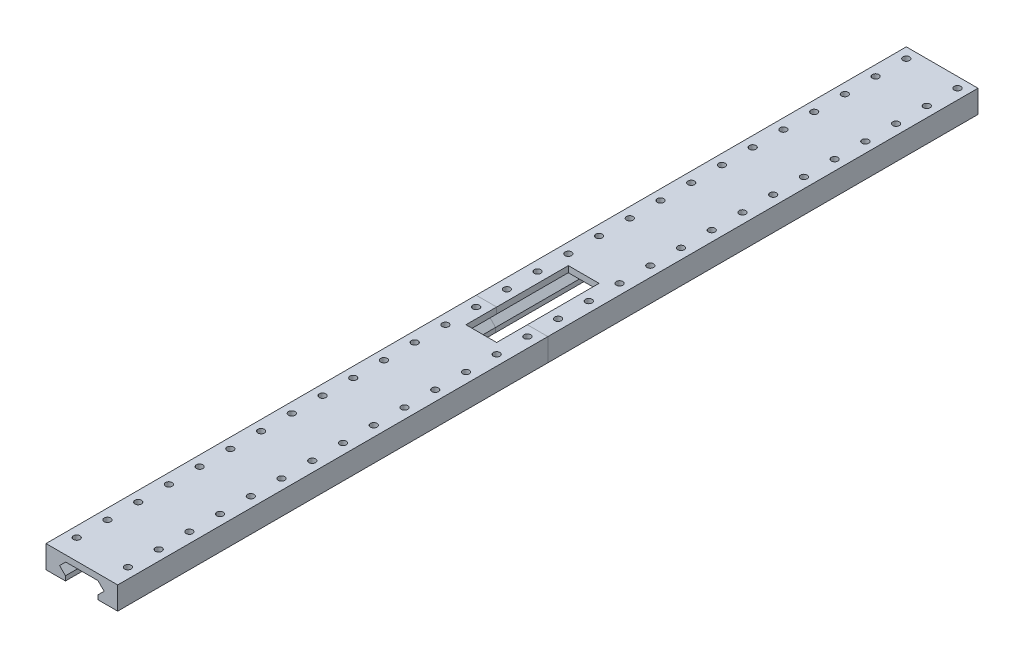
from build123d import *

# Parameters (mm, degrees)
EXTRUDE_2_DEPTH     = 420
SKETCH_3_R          = 1.6
CUT_EXTRUDE_1_DEPTH = 421.510951106
SKETCH_4_W          = 15
SKETCH_4_H          = 50
CUT_EXTRUDE_2_DEPTH = 421.510951106


with BuildPart() as part:
    # 草图1 → 凸台-拉伸2 (new body)
    with BuildSketch(Plane.XY):
        Polygon((8, 3.5), (17.5, 3.5), (17.5, 14.6), (-17.5, 14.6), (-17.5, 3.5), (-8, 3.5), (-8, 5.717157288), (-10.882842712, 8.6), (-7.882842712, 11.6), (7.882842712, 11.6), (10.882842712, 8.6), (8, 5.717157288), align=None)
    extrude(amount=EXTRUDE_2_DEPTH)

    # 草图3 → 切除-拉伸1 (cut, through all)
    with BuildSketch(Plane(origin=(0, 14.6, 0), x_dir=(1, 0, 0), z_dir=(0, 1, 0))):
        with Locations(Location((-12.5, -5, 0), (0, 0, 180))):
            Circle(SKETCH_3_R)
        with Locations(Location((-12.5, -20, 0), (0, 0, 180))):
            Circle(SKETCH_3_R)
        with Locations(Location((-12.5, -35, 0), (0, 0, 180))):
            Circle(SKETCH_3_R)
        with Locations(Location((-12.5, -50, 0), (0, 0, 180))):
            Circle(SKETCH_3_R)
        with Locations(Location((-12.5, -65, 0), (0, 0, 180))):
            Circle(SKETCH_3_R)
        with Locations(Location((-12.5, -80, 0), (0, 0, 180))):
            Circle(SKETCH_3_R)
        with Locations(Location((-12.5, -95, 0), (0, 0, 180))):
            Circle(SKETCH_3_R)
        with Locations(Location((-12.5, -110, 0), (0, 0, 180))):
            Circle(SKETCH_3_R)
        with Locations(Location((-12.5, -125, 0), (0, 0, 180))):
            Circle(SKETCH_3_R)
        with Locations(Location((-12.5, -140, 0), (0, 0, 180))):
            Circle(SKETCH_3_R)
        with Locations(Location((-12.5, -155, 0), (0, 0, 180))):
            Circle(SKETCH_3_R)
        with Locations(Location((-12.5, -170, 0), (0, 0, 180))):
            Circle(SKETCH_3_R)
        with Locations(Location((-12.5, -185, 0), (0, 0, 180))):
            Circle(SKETCH_3_R)
        with Locations(Location((-12.5, -200, 0), (0, 0, 180))):
            Circle(SKETCH_3_R)
        with Locations(Location((-12.5, -215, 0), (0, 0, 180))):
            Circle(SKETCH_3_R)
        with Locations(Location((-12.5, -230, 0), (0, 0, 180))):
            Circle(SKETCH_3_R)
        with Locations(Location((-12.5, -245, 0), (0, 0, 180))):
            Circle(SKETCH_3_R)
        with Locations(Location((-12.5, -260, 0), (0, 0, 180))):
            Circle(SKETCH_3_R)
        with Locations(Location((-12.5, -275, 0), (0, 0, 180))):
            Circle(SKETCH_3_R)
        with Locations(Location((-12.5, -290, 0), (0, 0, 180))):
            Circle(SKETCH_3_R)
        with Locations(Location((-12.5, -305, 0), (0, 0, 180))):
            Circle(SKETCH_3_R)
        with Locations(Location((-12.5, -320, 0), (0, 0, 180))):
            Circle(SKETCH_3_R)
        with Locations(Location((-12.5, -335, 0), (0, 0, 180))):
            Circle(SKETCH_3_R)
        with Locations(Location((-12.5, -350, 0), (0, 0, 180))):
            Circle(SKETCH_3_R)
        with Locations(Location((-12.5, -365, 0), (0, 0, 180))):
            Circle(SKETCH_3_R)
        with Locations(Location((-12.5, -380, 0), (0, 0, 180))):
            Circle(SKETCH_3_R)
        with Locations(Location((-12.5, -395, 0), (0, 0, 180))):
            Circle(SKETCH_3_R)
        with Locations(Location((-12.5, -410, 0), (0, 0, 180))):
            Circle(SKETCH_3_R)
        with Locations((12.5, -410)):
            Circle(SKETCH_3_R)
        with Locations((12.5, -395)):
            Circle(SKETCH_3_R)
        with Locations((12.5, -380)):
            Circle(SKETCH_3_R)
        with Locations((12.5, -365)):
            Circle(SKETCH_3_R)
        with Locations((12.5, -350)):
            Circle(SKETCH_3_R)
        with Locations((12.5, -335)):
            Circle(SKETCH_3_R)
        with Locations((12.5, -320)):
            Circle(SKETCH_3_R)
        with Locations((12.5, -305)):
            Circle(SKETCH_3_R)
        with Locations((12.5, -290)):
            Circle(SKETCH_3_R)
        with Locations((12.5, -275)):
            Circle(SKETCH_3_R)
        with Locations((12.5, -260)):
            Circle(SKETCH_3_R)
        with Locations((12.5, -245)):
            Circle(SKETCH_3_R)
        with Locations((12.5, -230)):
            Circle(SKETCH_3_R)
        with Locations((12.5, -215)):
            Circle(SKETCH_3_R)
        with Locations((12.5, -200)):
            Circle(SKETCH_3_R)
        with Locations((12.5, -185)):
            Circle(SKETCH_3_R)
        with Locations((12.5, -170)):
            Circle(SKETCH_3_R)
        with Locations((12.5, -155)):
            Circle(SKETCH_3_R)
        with Locations((12.5, -140)):
            Circle(SKETCH_3_R)
        with Locations((12.5, -125)):
            Circle(SKETCH_3_R)
        with Locations((12.5, -110)):
            Circle(SKETCH_3_R)
        with Locations((12.5, -95)):
            Circle(SKETCH_3_R)
        with Locations((12.5, -80)):
            Circle(SKETCH_3_R)
        with Locations((12.5, -65)):
            Circle(SKETCH_3_R)
        with Locations((12.5, -50)):
            Circle(SKETCH_3_R)
        with Locations((12.5, -35)):
            Circle(SKETCH_3_R)
        with Locations((12.5, -20)):
            Circle(SKETCH_3_R)
        with Locations((12.5, -5)):
            Circle(SKETCH_3_R)
    extrude(amount=-CUT_EXTRUDE_1_DEPTH, mode=Mode.SUBTRACT)

    # 草图4 → 切除-拉伸2 (cut, through all)
    with BuildSketch(Plane(origin=(0, 14.6, 0), x_dir=(1, 0, 0), z_dir=(0, 1, 0))):
        with Locations((0, -200)):
            Rectangle(SKETCH_4_W, SKETCH_4_H)
    extrude(amount=-CUT_EXTRUDE_2_DEPTH, mode=Mode.SUBTRACT)


with BuildPart() as body_2:
    # Split Bodies 1: the piece on the far side of the plane
    add(part.part)
    split(bisect_by=Plane(origin=(0, 0, 210), x_dir=(-1, 0, 0), z_dir=(0, 0, -1)), keep=Keep.BOTTOM)


with BuildPart() as part_1:
    add(part.part)

    # Split Bodies 1
    split(bisect_by=Plane(origin=(0, 0, 210), x_dir=(-1, 0, 0), z_dir=(0, 0, -1)), keep=Keep.TOP)


solid = Compound([body_2.part, part_1.part])
